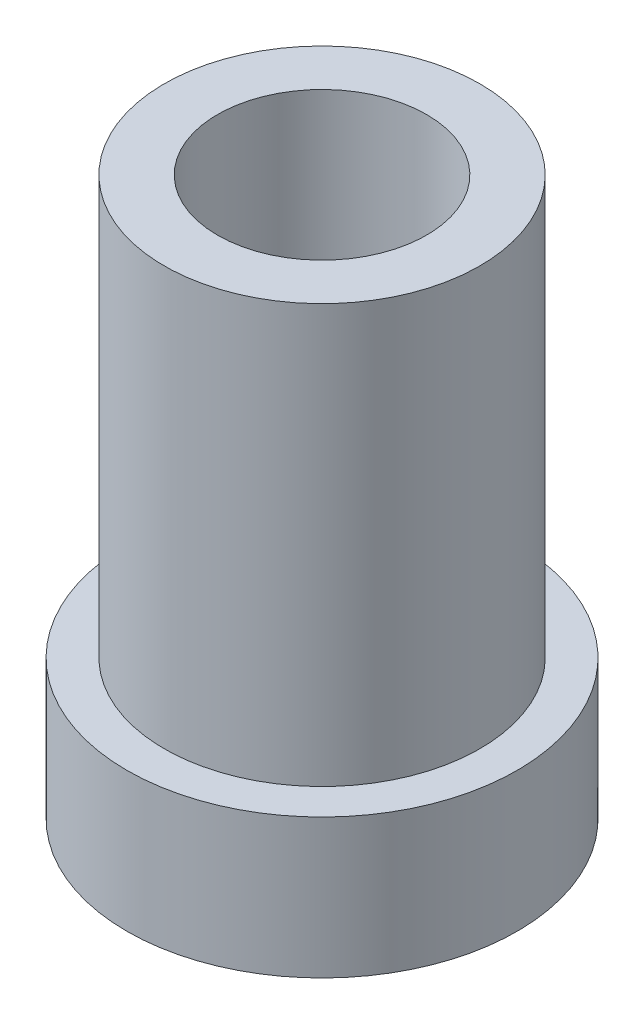
from build123d import *

# Parameters (mm, degrees)
SKETCH1_R           = 4.445
BOSS_EXTRUDE1_DEPTH = 3.175
SKETCH2_R           = 3.5941
BOSS_EXTRUDE2_DEPTH = 9.525
SKETCH3_R           = 2.38125
CUT_EXTRUDE1_DEPTH  = 12.7


with BuildPart() as part:
    # Sketch1 → Boss-Extrude1 (new body)
    with BuildSketch(Plane(origin=(0, 0, 0), x_dir=(1, 0, 0), z_dir=(0, 1, 0))):
        with Locations(Location((0, 0, 0), (0, 0, 270))):
            Circle(SKETCH1_R)
    extrude(amount=BOSS_EXTRUDE1_DEPTH)

    # Sketch2 → Boss-Extrude2 (add)
    with BuildSketch(Plane(origin=(0, 3.175, 0), x_dir=(1, 0, 0), z_dir=(0, 1, 0))):
        with Locations(Location((0, 0, 0), (0, 0, 90))):
            Circle(SKETCH2_R)
    extrude(amount=BOSS_EXTRUDE2_DEPTH)

    # Sketch3 → Cut-Extrude1 (cut)
    with BuildSketch(Plane(origin=(0, 12.7, 0), x_dir=(1, 0, 0), z_dir=(0, 1, 0))):
        with Locations(Location((0, 0, 0), (0, 0, 270))):
            Circle(SKETCH3_R)
    extrude(amount=-CUT_EXTRUDE1_DEPTH, mode=Mode.SUBTRACT)


solid = part.part
